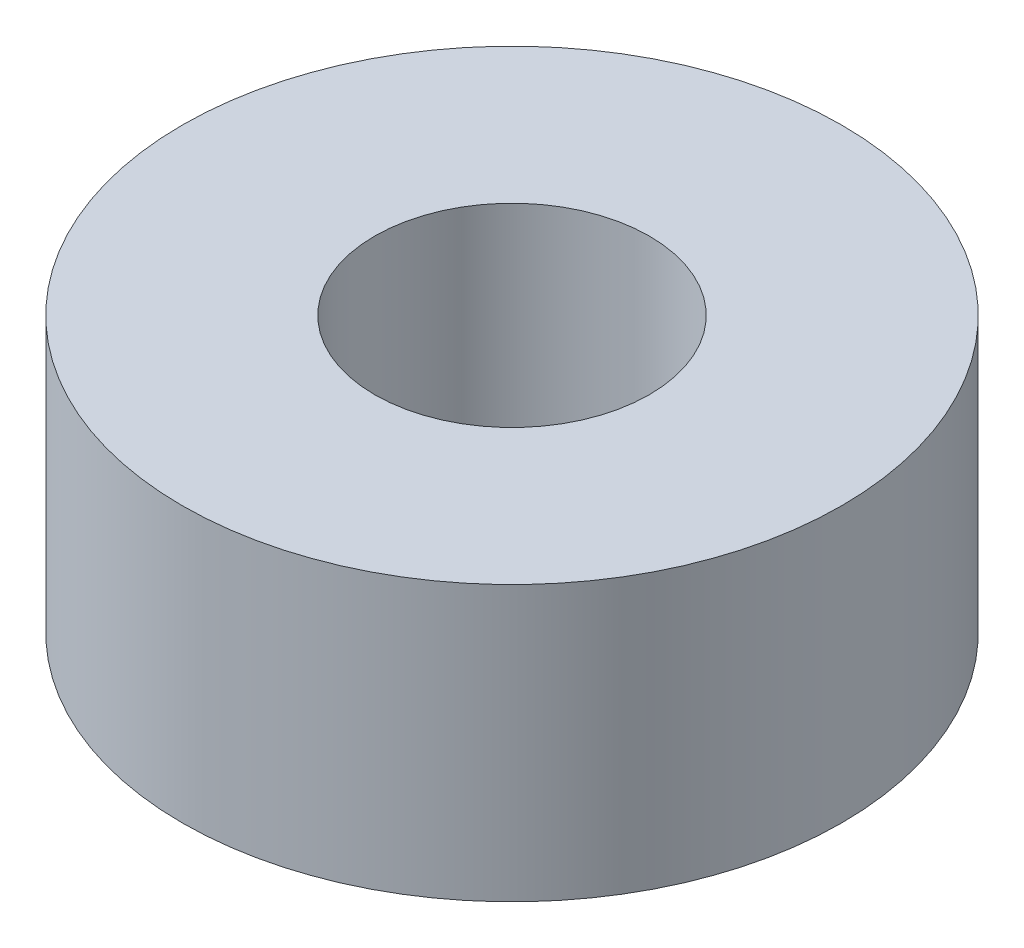
from build123d import *

# Parameters (mm, degrees)
SKETCH1_R           = 6
SKETCH1_R_2         = 2.5
BOSS_EXTRUDE1_DEPTH = 5


with BuildPart() as part:
    # Sketch1 → Boss-Extrude1 (new body)
    with BuildSketch(Plane(origin=(0, 0, 0), x_dir=(1, 0, 0), z_dir=(0, 1, 0))):
        with Locations(Location((0, 0, 0), (0, 0, 270))):
            Circle(SKETCH1_R)
        with Locations(Location((0, 0, 0), (0, 0, 270))):
            Circle(SKETCH1_R_2, mode=Mode.SUBTRACT)
    extrude(amount=BOSS_EXTRUDE1_DEPTH)


solid = part.part
